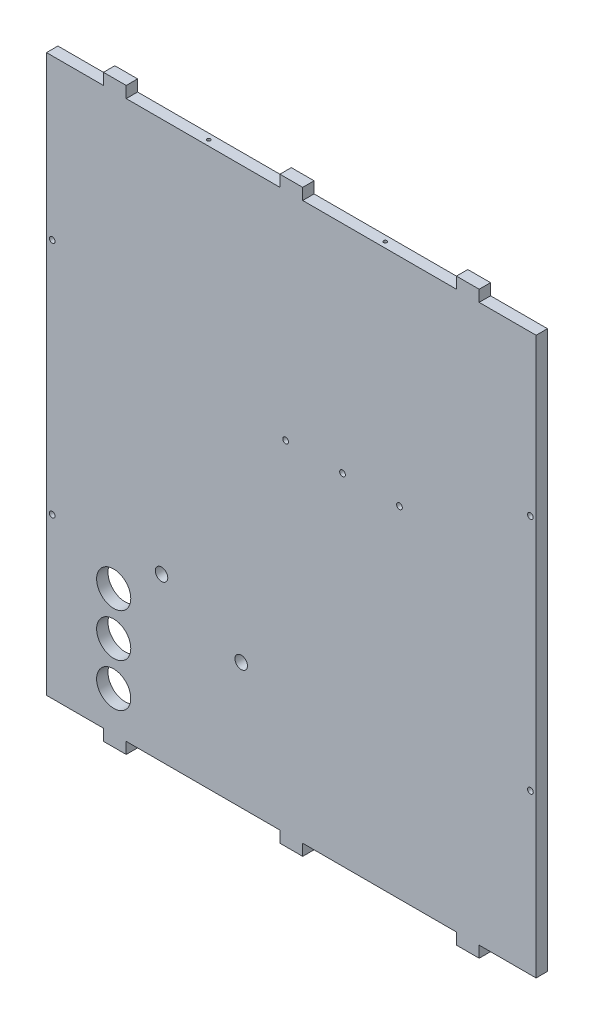
from build123d import *
from build123d.topology import SkipClean

# Parameters (mm, degrees)
SKIZZE1_W                       = 5
SKIZZE1_H                       = 5
SKIZZE1_W_2                     = 15
AUFSATZ_LINEAR_AUSTRAGEN1_DEPTH = 5
SKIZZE2_R                       = 2.75
SCHNITT_LINEAR_AUSTRAGEN1_DEPTH = 128.539996178
SCHNITT_LINEAR_AUSTRAGEN2_DEPTH = 128.539996178
SKIZZE4_R                       = 7.5
SCHNITT_LINEAR_AUSTRAGEN3_DEPTH = 128.539996178
SKIZZE5_R                       = 0.75
SKIZZE5_R_2                     = 6
SENSORS_DEPTH                   = 128.539996178
AUFSATZ_LINEAR_AUSTRAGEN2_DEPTH = 5
SKIZZE7_R                       = 1.25
SCHNITT_LINEAR_AUSTRAGEN5_DEPTH = 239.81729549
SKETCH1_W                       = 69.5
SKETCH1_H                       = 110
BOSS_EXTRUDE1_DEPTH             = 5
SKIZZE9_R                       = 0.75
SKIZZE9_R_2                     = 6
DISCRETECHANNEL_DEPTH           = 239.81729549
SKIZZE10_R                      = 0.75
SKIZZE10_R_2                    = 6
CONTCHANNEL_DEPTH               = 239.81729549
BOSS_EXTRUDE2_DEPTH             = 5
SKIZZE8_R                       = 0.75
SKIZZE8_R_2                     = 7.5
STEPDOWNCONVERTER_DEPTH         = 239.81729549
SKETCH3_R                       = 0.75
SKETCH3_R_2                     = 5
BBB_DEPTH                       = 5
BOSS_EXTRUDE3_DEPTH             = 5
SKETCH5_W                       = 55
SKETCH5_H                       = 244.45
CUT_EXTRUDE2_DEPTH              = 5
SKETCH6_R                       = 5
CUT_EXTRUDE3_DEPTH              = 5
SKETCH7_W                       = 5
SKETCH7_H                       = 10
BOSS_EXTRUDE4_DEPTH             = 5
SKETCH8_W                       = 10
SKETCH8_H                       = 5
BOSS_EXTRUDE5_DEPTH             = 5
BOSS_EXTRUDE6_START             = -5
SKETCH9_W                       = 210
SKETCH9_H                       = 244.45
SKETCH9_R                       = 2.75
SKETCH9_R_2                     = 7.5
BOSS_EXTRUDE6_DEPTH             = 5
SKETCH10_R                      = 1.25
CUT_EXTRUDE4_DEPTH              = 5
SKETCH11_R                      = 1.25
CUT_EXTRUDE5_DEPTH              = 211.370983325
SKETCH12_R                      = 0.75
CUT_EXTRUDE6_DEPTH              = 10
SKETCH13_W                      = 5
SKETCH13_H                      = 244.45
BOSS_EXTRUDE7_DEPTH             = 5
SKETCH14_R                      = 1.25
CUT_EXTRUDE7_DEPTH              = 5
SKETCH15_R                      = 1.25
BOSS_EXTRUDE8_DEPTH             = 5


with BuildPart() as part:
    # Skizze1 → Aufsatz-Linear austragen1 (new body)
    with BuildSketch(Plane.XY):
        Polygon((55, 67.225), (75, 67.225), (75, 72.225), (85, 72.225), (85, 67.225), (100, 67.225), (100, 47.225), (105, 47.225), (105, 37.225), (100, 37.225), (100, -37.225), (105, -37.225), (105, -47.225), (100, -47.225), (100, -67.225), (-100, -67.225), (-100, -47.225), (-105, -47.225), (-105, -37.225), (-100, -37.225), (-100, 37.225), (-105, 37.225), (-105, 47.225), (-100, 47.225), (-100, 67.225), (-85, 67.225), (-85, 72.225), (-75, 72.225), (-75, 67.225), (45, 67.225), (45, 72.225), (55, 72.225), align=None)
        with Locations((13, -40.055)):
            Rectangle(SKIZZE1_W, SKIZZE1_H, mode=Mode.SUBTRACT)
        with Locations((53, -40.055)):
            Rectangle(SKIZZE1_W, SKIZZE1_H, mode=Mode.SUBTRACT)
        with Locations((33, -40.055)):
            Rectangle(SKIZZE1_W_2, SKIZZE1_H, mode=Mode.SUBTRACT)
    extrude(amount=AUFSATZ_LINEAR_AUSTRAGEN1_DEPTH)

    # Skizze2 → Schnitt-Linear austragen1 (cut, through all)
    with BuildSketch(Plane.XY.offset(5)):
        with Locations((-59.5, 4.075)):
            Circle(SKIZZE2_R)
        with Locations((-24.5, -11.925)):
            Circle(SKIZZE2_R)
    extrude(amount=-SCHNITT_LINEAR_AUSTRAGEN1_DEPTH, mode=Mode.SUBTRACT)

    # Skizze3 → Schnitt-Linear austragen2 (cut, through all)
    with BuildSketch(Plane.XY.offset(5)):
        with BuildLine():
            Line((25, -17.555), (41, -17.555))
            ThreePointArc((41, -17.555), (42.414213562, -18.140786438), (43, -19.555))
            Line((43, -19.555), (43, -35.555))
            ThreePointArc((43, -35.555), (42.414213562, -36.969213562), (41, -37.555))
            Line((41, -37.555), (37, -37.555))
            Line((37, -37.555), (29, -37.555))
            Line((29, -37.555), (25, -37.555))
            ThreePointArc((25, -37.555), (23.585786438, -36.969213562), (23, -35.555))
            Line((23, -35.555), (23, -19.555))
            ThreePointArc((23, -19.555), (23.585786438, -18.140786438), (25, -17.555))
        make_face()
        with BuildLine():
            Line((-66.5, 54.225), (-66.5, 35.225))
            ThreePointArc((-66.5, 35.225), (-67.378679656, 33.103679656), (-69.5, 32.225))
            Line((-69.5, 32.225), (-88.5, 32.225))
            ThreePointArc((-88.5, 32.225), (-90.621320344, 33.103679656), (-91.5, 35.225))
            Line((-91.5, 35.225), (-91.5, 54.225))
            ThreePointArc((-91.5, 54.225), (-90.621320344, 56.346320344), (-88.5, 57.225))
            Line((-88.5, 57.225), (-69.5, 57.225))
            ThreePointArc((-69.5, 57.225), (-67.378679656, 56.346320344), (-66.5, 54.225))
        make_face()
        with BuildLine():
            Line((4.5, 57.225), (-14.5, 57.225))
            ThreePointArc((-14.5, 57.225), (-16.621320344, 56.346320344), (-17.5, 54.225))
            Line((-17.5, 54.225), (-17.5, 35.225))
            ThreePointArc((-17.5, 35.225), (-16.621320344, 33.103679656), (-14.5, 32.225))
            Line((-14.5, 32.225), (4.5, 32.225))
            ThreePointArc((4.5, 32.225), (6.621320344, 33.103679656), (7.5, 35.225))
            Line((7.5, 35.225), (7.5, 54.225))
            ThreePointArc((7.5, 54.225), (6.621320344, 56.346320344), (4.5, 57.225))
        make_face()
    extrude(amount=-SCHNITT_LINEAR_AUSTRAGEN2_DEPTH, mode=Mode.SUBTRACT)

    # Skizze4 → Schnitt-Linear austragen3 (cut, through all)
    with BuildSketch(Plane.XY.offset(5)):
        with Locations((-80.5, -30.925)):
            Circle(SKIZZE4_R)
        with Locations((-80.5, -11.925)):
            Circle(SKIZZE4_R)
        with Locations(Location((-80.5, -49.925, 0), (0, 0, 180))):
            Circle(SKIZZE4_R)
    extrude(amount=-SCHNITT_LINEAR_AUSTRAGEN3_DEPTH, mode=Mode.SUBTRACT)

    # Skizze5 → Sensors (cut, through all)
    with BuildSketch(Plane.XY.offset(5)):
        with Locations((-8, -45.225)):
            Circle(SKIZZE5_R)
        with Locations((-8, -3.225)):
            Circle(SKIZZE5_R)
        with Locations((83, -12.225)):
            Circle(SKIZZE5_R)
        with Locations((-15, -56.225)):
            Circle(SKIZZE5_R_2)
        with Locations((0, -56.225)):
            Circle(SKIZZE5_R_2)
        with Locations((15, -56.225)):
            Circle(SKIZZE5_R_2)
        with Locations((30, -56.225)):
            Circle(SKIZZE5_R_2)
        with Locations((45, -56.225)):
            Circle(SKIZZE5_R_2)
        with Locations((60, -56.225)):
            Circle(SKIZZE5_R_2)
        with Locations((75, -56.225)):
            Circle(SKIZZE5_R_2)
        with Locations((90, -56.225)):
            Circle(SKIZZE5_R_2)
    extrude(amount=-SENSORS_DEPTH, mode=Mode.SUBTRACT)

    # Skizze6 → Aufsatz-Linear austragen2 (add)
    with BuildSketch(Plane(origin=(0, 0, 0), x_dir=(-1, 0, 0), z_dir=(0, 0, -1))):
        Polygon((160, 47.225), (160, 37.225), (160, -37.225), (160, -47.225), (160, -67.225), (100, -67.225), (100, 67.225), (-30.5, 67.225), (-30.5, 177.225), (160, 177.225), (160, 67.225), align=None)
    extrude(amount=-AUFSATZ_LINEAR_AUSTRAGEN2_DEPTH)

    # Skizze7 → Schnitt-Linear austragen5 (cut, through all)
    with BuildSketch(Plane(origin=(0, 0, 0), x_dir=(-1, 0, 0), z_dir=(0, 0, -1))):
        with Locations((71.5, 32.775)):
            Circle(SKIZZE7_R)
        with Locations((96.5, 32.775)):
            Circle(SKIZZE7_R)
        with Locations((46.5, 32.775)):
            Circle(SKIZZE7_R)
    extrude(amount=-SCHNITT_LINEAR_AUSTRAGEN5_DEPTH, mode=Mode.SUBTRACT)

    # Sketch1 → Boss-Extrude1 (add)
    with BuildSketch(Plane.XY.offset(5)):
        with Locations((65.25, 122.225)):
            Rectangle(SKETCH1_W, SKETCH1_H)
    extrude(amount=-BOSS_EXTRUDE1_DEPTH)

    # Skizze9 → DiscreteChannel (cut, through all)
    with BuildSketch(Plane.XY.offset(5)):
        with Locations((8, 71.515)):
            Circle(SKIZZE9_R)
        with Locations(Location((69, 71.515, 0), (0, 0, 180))):
            Circle(SKIZZE9_R)
        with Locations(Location((8, 10.515, 0), (0, 0, 180))):
            Circle(SKIZZE9_R)
        with Locations((69, 10.515)):
            Circle(SKIZZE9_R)
        with Locations((-2, 5.015)):
            Circle(SKIZZE9_R_2)
        with Locations((-2, 29.015)):
            Circle(SKIZZE9_R_2)
        with Locations((-2, 53.015)):
            Circle(SKIZZE9_R_2)
        with Locations((-2, 77.015)):
            Circle(SKIZZE9_R_2)
    extrude(amount=-DISCRETECHANNEL_DEPTH, mode=Mode.SUBTRACT)

    # Skizze10 → ContChannel (cut, through all)
    with BuildSketch(Plane.XY.offset(5)):
        with Locations((-4, 136.225)):
            Circle(SKIZZE10_R)
        with Locations(Location((-4, 94.225, 0), (0, 0, 180))):
            Circle(SKIZZE10_R)
        with Locations(Location((-96, 136.225, 0), (0, 0, 180))):
            Circle(SKIZZE10_R)
        with Locations((-96, 94.225)):
            Circle(SKIZZE10_R)
        with Locations((-72.499999267, 166.225)):
            Circle(SKIZZE10_R_2)
        with Locations((-57.499999267, 166.225)):
            Circle(SKIZZE10_R_2)
        with Locations((-42.499999267, 166.225)):
            Circle(SKIZZE10_R_2)
        with Locations((-27.499999267, 166.225)):
            Circle(SKIZZE10_R_2)
        with Locations((-27.499999267, 151.225)):
            Circle(SKIZZE10_R_2)
        with Locations((-42.499999267, 151.225)):
            Circle(SKIZZE10_R_2)
        with Locations((-57.499999267, 151.225)):
            Circle(SKIZZE10_R_2)
        with Locations((-72.499999267, 151.225)):
            Circle(SKIZZE10_R_2)
    extrude(amount=-CONTCHANNEL_DEPTH, mode=Mode.SUBTRACT)

    # Sketch2 → Boss-Extrude2 (add)
    with SkipClean():  # the faces are left unmerged after this step: merging them gives an invalid solid
        with BuildSketch(Plane.XY.offset(5)):
            with BuildLine():
                Line((-14.5, 32.225), (-7.069112348, 32.225))
                ThreePointArc((-7.069112348, 32.225), (-2, 35.015), (3.069112348, 32.225))
                Line((3.069112348, 32.225), (4.5, 32.225))
                ThreePointArc((4.5, 32.225), (6.621320344, 33.103679656), (7.5, 35.225))
                Line((7.5, 35.225), (7.5, 54.225))
                ThreePointArc((7.5, 54.225), (6.621320344, 56.346320344), (4.5, 57.225))
                Line((4.5, 57.225), (2.275032164, 57.225))
                ThreePointArc((2.275032164, 57.225), (-2, 47.015), (-6.275032164, 57.225))
                Line((-6.275032164, 57.225), (-14.5, 57.225))
                ThreePointArc((-14.5, 57.225), (-16.621320344, 56.346320344), (-17.5, 54.225))
                Line((-17.5, 54.225), (-17.5, 35.225))
                ThreePointArc((-17.5, 35.225), (-16.621320344, 33.103679656), (-14.5, 32.225))
            make_face()
        extrude(amount=-BOSS_EXTRUDE2_DEPTH)

    # Skizze8 → StepDownConverter (cut, through all)
    with SkipClean():  # the faces are left unmerged after this step: merging them gives an invalid solid
        with BuildSketch(Plane.XY.offset(5)):
            with Locations((62.5, 153.225)):
                Circle(SKIZZE8_R)
            with Locations(Location((93.5, 153.225, 0), (0, 0, 180))):
                Circle(SKIZZE8_R)
            with Locations(Location((62.5, 100.225, 0), (0, 0, 180))):
                Circle(SKIZZE8_R)
            with Locations((93.5, 100.225)):
                Circle(SKIZZE8_R)
            with Locations((78, 86.225)):
                Circle(SKIZZE8_R_2)
            with Locations(Location((78, 167.225, 0), (0, 0, 180))):
                Circle(SKIZZE8_R_2)
        extrude(amount=-STEPDOWNCONVERTER_DEPTH, mode=Mode.SUBTRACT)

    # Sketch3 → BBB (cut)
    with SkipClean():  # the faces are left unmerged after this step: merging them gives an invalid solid
        with BuildSketch(Plane.XY.offset(5)):
            with Locations((21.85, 147.68)):
                Circle(SKETCH3_R)
            with Locations((87.89, 102.59)):
                Circle(SKETCH3_R)
            with Locations(Location((87.89, 150.86, 0), (0, 0, 180))):
                Circle(SKETCH3_R)
            with Locations(Location((21.85, 105.77, 0), (0, 0, 180))):
                Circle(SKETCH3_R)
            with Locations((13, 167.225)):
                Circle(SKETCH3_R_2)
            with Locations((28, 167.225)):
                Circle(SKETCH3_R_2)
            with Locations((43, 167.225)):
                Circle(SKETCH3_R_2)
            with Locations((58, 167.225)):
                Circle(SKETCH3_R_2)
            with Locations(Location((13, 86.225, 0), (0, 0, 180))):
                Circle(SKETCH3_R_2)
        extrude(amount=-BBB_DEPTH, mode=Mode.SUBTRACT)

    # Sketch4 → Boss-Extrude3 (add)
    with SkipClean():  # the faces are left unmerged after this step: merging them gives an invalid solid
        with BuildSketch(Plane.XY.offset(5)):
            with BuildLine():
                Line((-88.5, 32.225), (-72.622497216, 32.225))
                ThreePointArc((-72.622497216, 32.225), (-71.5, 34.025), (-70.377502784, 32.225))
                Line((-70.377502784, 32.225), (-69.5, 32.225))
                ThreePointArc((-69.5, 32.225), (-67.378679656, 33.103679656), (-66.5, 35.225))
                Line((-66.5, 35.225), (-66.5, 54.225))
                ThreePointArc((-66.5, 54.225), (-67.378679656, 56.346320344), (-69.5, 57.225))
                Line((-69.5, 57.225), (-88.5, 57.225))
                ThreePointArc((-88.5, 57.225), (-90.621320344, 56.346320344), (-91.5, 54.225))
                Line((-91.5, 54.225), (-91.5, 35.225))
                ThreePointArc((-91.5, 35.225), (-90.621320344, 33.103679656), (-88.5, 32.225))
            make_face()
        extrude(amount=-BOSS_EXTRUDE3_DEPTH)

    # Sketch5 → Cut-Extrude2 (cut)
    with SkipClean():  # the faces are left unmerged after this step: merging them gives an invalid solid
        with BuildSketch(Plane.XY.offset(5)):
            with Locations((-132.5, 55)):
                Rectangle(SKETCH5_W, SKETCH5_H)
        extrude(amount=-CUT_EXTRUDE2_DEPTH, mode=Mode.SUBTRACT)

    # Sketch6 → Cut-Extrude3 (cut)
    with SkipClean():  # the faces are left unmerged after this step: merging them gives an invalid solid
        with BuildSketch(Plane.XY.offset(5)):
            with Locations((-95, 82.775)):
                Circle(SKETCH6_R)
            with Locations((-80, 82.775)):
                Circle(SKETCH6_R)
            with Locations((-95, -32.225)):
                Circle(SKETCH6_R)
            with Locations((-65, 82.775)):
                Circle(SKETCH6_R)
        extrude(amount=-CUT_EXTRUDE3_DEPTH, mode=Mode.SUBTRACT)

    # Sketch7 → Boss-Extrude4 (add)
    with SkipClean():  # the faces are left unmerged after this step: merging them gives an invalid solid
        with BuildSketch(Plane.XY.offset(5)):
            with Locations((102.5, 152.225)):
                Rectangle(SKETCH7_W, SKETCH7_H)
        extrude(amount=-BOSS_EXTRUDE4_DEPTH)

    # Sketch8 → Boss-Extrude5 (add)
    with SkipClean():  # the faces are left unmerged after this step: merging them gives an invalid solid
        with BuildSketch(Plane.XY.offset(5)):
            with Locations((-80, -69.725)):
                Rectangle(SKETCH8_W, SKETCH8_H)
            with Locations((-2.5, -69.725)):
                Rectangle(SKETCH8_W, SKETCH8_H)
            with Locations((75, -69.725)):
                Rectangle(SKETCH8_W, SKETCH8_H)
            with Locations((75, 179.725)):
                Rectangle(SKETCH8_W, SKETCH8_H)
            with Locations((-2.5, 179.725)):
                Rectangle(SKETCH8_W, SKETCH8_H)
            with Locations((-80, 179.725)):
                Rectangle(SKETCH8_W, SKETCH8_H)
        extrude(amount=-BOSS_EXTRUDE5_DEPTH)

    # Sketch9 → Boss-Extrude6 (add)
    with BuildSketch(Plane(origin=(0, 0, 0), x_dir=(-1, 0, 0), z_dir=(0, 0, -1)).offset(BOSS_EXTRUDE6_START)):
        with Locations((0, 55)):
            Rectangle(SKETCH9_W, SKETCH9_H)
        with Locations(Location((59.5, 4.075, 0), (0, 0, 180))):
            Circle(SKETCH9_R, mode=Mode.SUBTRACT)
        with Locations(Location((24.5, -11.925, 0), (0, 0, 180))):
            Circle(SKETCH9_R, mode=Mode.SUBTRACT)
        with Locations((80.5, -49.925)):
            Circle(SKETCH9_R_2, mode=Mode.SUBTRACT)
        with Locations(Location((80.5, -30.925, 0), (0, 0, 180))):
            Circle(SKETCH9_R_2, mode=Mode.SUBTRACT)
        with Locations(Location((80.5, -11.925, 0), (0, 0, 180))):
            Circle(SKETCH9_R_2, mode=Mode.SUBTRACT)
    extrude(amount=BOSS_EXTRUDE6_DEPTH)

    # Sketch10 → Cut-Extrude4 (cut)
    with BuildSketch(Plane(origin=(0, 0, 0), x_dir=(-1, 0, 0), z_dir=(0, 0, -1))):
        with Locations((-45, 82.225)):
            Circle(SKETCH10_R)
        with Locations((-20, 82.225)):
            Circle(SKETCH10_R)
        with Locations((5, 82.225)):
            Circle(SKETCH10_R)
    extrude(amount=-CUT_EXTRUDE4_DEPTH, mode=Mode.SUBTRACT)

    # Sketch11 → Cut-Extrude5 (cut, through all)
    with BuildSketch(Plane(origin=(0, 0, 0), x_dir=(-1, 0, 0), z_dir=(0, 0, -1))):
        with Locations((-102.5, 107.225)):
            Circle(SKETCH11_R)
        with Locations(Location((-102.5, 2.775, 0), (0, 0, 180))):
            Circle(SKETCH11_R)
        with Locations((102.5, 2.775)):
            Circle(SKETCH11_R)
        with Locations(Location((102.5, 107.225, 0), (0, 0, 180))):
            Circle(SKETCH11_R)
    extrude(amount=-CUT_EXTRUDE5_DEPTH, mode=Mode.SUBTRACT)

    # Sketch12 → Cut-Extrude6 (cut)
    with BuildSketch(Plane(origin=(0, 177.225, 0), x_dir=(1, 0, 0), z_dir=(0, 1, 0))):
        with Locations(Location((-41.25, -2.5, 0), (0, 0, 270))):
            Circle(SKETCH12_R)
        with Locations(Location((36.25, -2.5, 0), (0, 0, 270))):
            Circle(SKETCH12_R)
    cut_extrude6 = extrude(amount=-CUT_EXTRUDE6_DEPTH, mode=Mode.SUBTRACT)

    # Mirror1: Cut-Extrude6 across plane
    add(cut_extrude6.mirror(Plane.ZX.offset(55)), mode=Mode.SUBTRACT)

    # Sketch13 → Boss-Extrude7 (add)
    with BuildSketch(Plane.ZY.offset(105)):
        with Locations((2.5, 55)):
            Rectangle(SKETCH13_W, SKETCH13_H)
    extrude(amount=BOSS_EXTRUDE7_DEPTH)

    # Sketch14 → Cut-Extrude7 (cut)
    with BuildSketch(Plane(origin=(0, 0, 0), x_dir=(-1, 0, 0), z_dir=(0, 0, -1))):
        with Locations((102.5, 2.775)):
            Circle(SKETCH14_R)
        with Locations(Location((102.5, 107.225, 0), (0, 0, 180))):
            Circle(SKETCH14_R)
        with Locations((107.5, 2.775)):
            Circle(SKETCH14_R)
        with Locations((107.5, 107.225)):
            Circle(SKETCH14_R)
    extrude(amount=-CUT_EXTRUDE7_DEPTH, mode=Mode.SUBTRACT)

    # Sketch15 → Boss-Extrude8 (add)
    with BuildSketch(Plane(origin=(0, 0, 0), x_dir=(-1, 0, 0), z_dir=(0, 0, -1))):
        with Locations((102.5, 2.775)):
            Circle(SKETCH15_R)
        with Locations((102.5, 107.225)):
            Circle(SKETCH15_R)
    extrude(amount=-BOSS_EXTRUDE8_DEPTH)


solid = part.part
